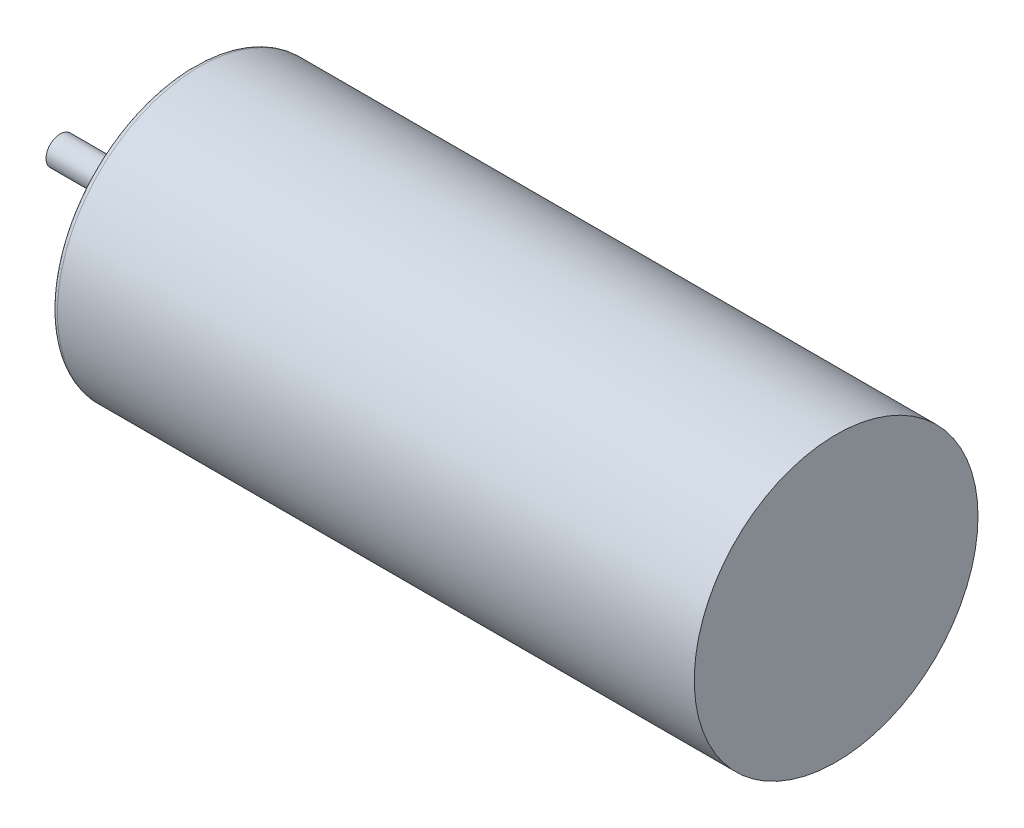
from build123d import *

# Parameters (mm, degrees)
ESBO_O2_R                = 5
RESSALTO_EXTRUS_O1_DEPTH = 22.65
ESBO_O3_R                = 0.5
RESSALTO_EXTRUS_O2_DEPTH = 4.7
ESBO_O4_R                = 1
RESSALTO_EXTRUS_O3_DEPTH = 0.5
FILETE1_R                = 0.2


with BuildPart() as part:
    # Esboço2 → Ressalto-extrusão1 (new body)
    with BuildSketch(Plane(origin=(0, 0, 0), x_dir=(0, 0, -1), z_dir=(1, 0, 0))):
        Circle(ESBO_O2_R)
    extrude(amount=-RESSALTO_EXTRUS_O1_DEPTH)

    # Esboço3 → Ressalto-extrusão2 (add)
    with BuildSketch(Plane.ZY.offset(22.65)):
        with Locations(Location((0, 0, 0), (0, 0, 180))):
            Circle(ESBO_O3_R)
    extrude(amount=RESSALTO_EXTRUS_O2_DEPTH)

    # Esboço4 → Ressalto-extrusão3 (add)
    with BuildSketch(Plane.ZY.offset(22.65)):
        with Locations(Location((0, 0, 0), (0, 0, 180))):
            Circle(ESBO_O4_R)
    extrude(amount=RESSALTO_EXTRUS_O3_DEPTH)

    # Filete1
    filete1_edges = [part.edges().sort_by_distance(p)[0] for p in [
        (-22.65, 0, 5),
    ]]
    fillet(filete1_edges, radius=FILETE1_R)


solid = part.part
